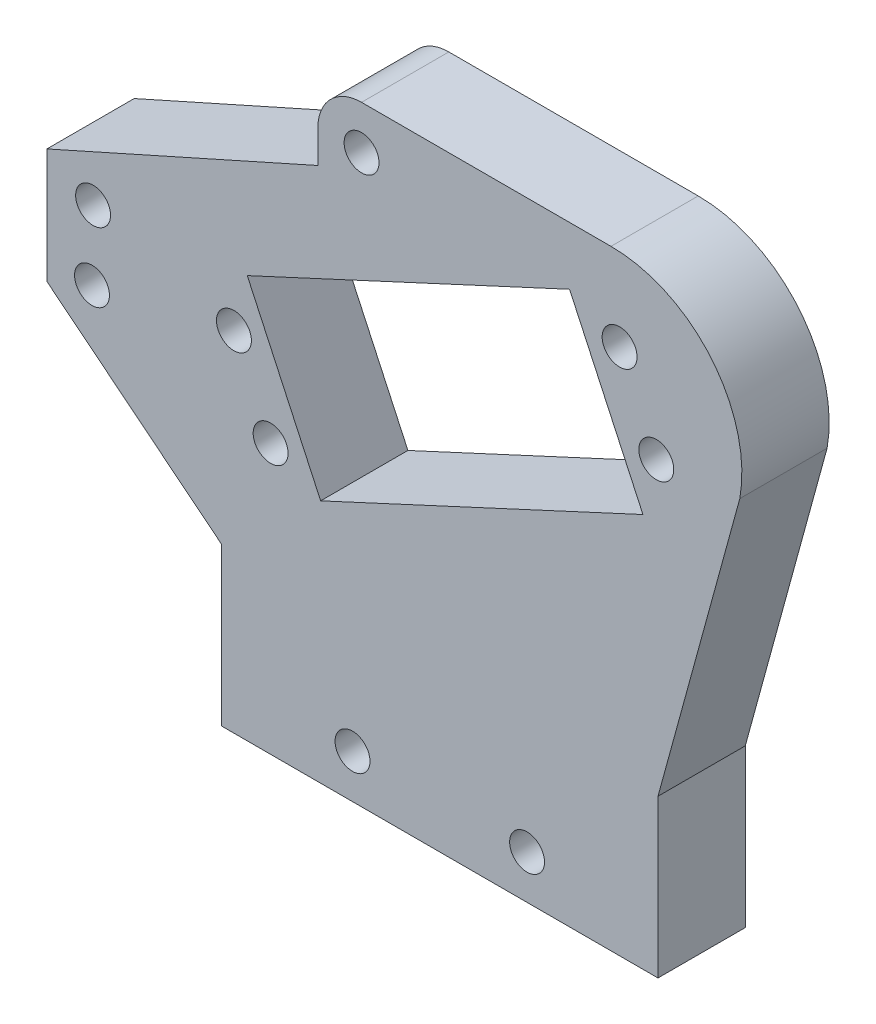
from build123d import *

# Parameters (mm, degrees)
SCHIZZO1_R                   = 2.5
SCHIZZO1_R_2                 = 2
ESTRUSIONE_ESTRUSIONE1_DEPTH = 10
TAGLIO_ESTRUSIONE1_DEPTH     = 76.013178039
SCHIZZO3_R                   = 2
TAGLIO_ESTRUSIONE2_DEPTH     = 76.013178039


with BuildPart() as part:
    # Schizzo1 → Estrusione-Estrusione1 (new body)
    with BuildSketch(Plane.XY):
        with BuildLine():
            Line((15, -50), (-35, -50))
            Line((-35, -50), (-35, -31.964890017))
            Line((-35, -31.964890017), (-55.017968697, -15.891116751))
            Line((-55.017968697, -15.891116751), (-55.017968697, -2.739847716))
            Line((-55.017968697, -2.739847716), (-23.966361252, 11.142047377))
            Line((-23.966361252, 11.142047377), (-23.966361252, 14.909560068))
            ThreePointArc((-23.966361252, 14.909560068), (-22.501895158, 18.445093974), (-18.966361252, 19.909560068))
            Line((-18.966361252, 19.909560068), (9.612052016, 19.909560068))
            ThreePointArc((9.612052016, 19.909560068), (21.117133083, 14.534169651), (24.376307149, 2.260641352))
            Line((24.376307149, 2.260641352), (15, -31.964890017))
            Line((15, -31.964890017), (15, -50))
        make_face()
        Circle(SCHIZZO1_R, mode=Mode.SUBTRACT)
        with Locations((-20, -45)):
            Circle(SCHIZZO1_R_2, mode=Mode.SUBTRACT)
        with Locations((0, -45)):
            Circle(SCHIZZO1_R_2, mode=Mode.SUBTRACT)
        with Locations((-49.725907234, -5.689936133)):
            Circle(SCHIZZO1_R_2, mode=Mode.SUBTRACT)
        with Locations((-49.850768961, -13.68896167)):
            Circle(SCHIZZO1_R_2, mode=Mode.SUBTRACT)
        with Locations((-18.966361252, 14.909560068)):
            Circle(SCHIZZO1_R_2, mode=Mode.SUBTRACT)
    extrude(amount=ESTRUSIONE_ESTRUSIONE1_DEPTH)

    # Schizzo2 → Taglio-Estrusione1 (cut, through all)
    with BuildSketch(Plane.XY.offset(10)):
        with BuildLine():
            Line((-27.856099407, -12.90456221), (-2.268412004, -1.050860115))
            ThreePointArc((-2.268412004, -1.050860115), (-1.050860115, 2.268412004), (2.268412004, 1.050860115))
            Line((2.268412004, 1.050860115), (9.073648015, 4.203440459))
            Line((9.073648015, 4.203440459), (4.870207556, 13.277088475))
            Line((4.870207556, 13.277088475), (-32.059539866, -3.830914194))
            Line((-32.059539866, -3.830914194), (-27.856099407, -12.90456221))
        make_face()
        with BuildLine():
            ThreePointArc((2.5, 0), (0.538038098, -2.441416598), (-2.268412004, -1.050860115))
            Line((-2.268412004, -1.050860115), (-27.856099407, -12.90456221))
            Line((-27.856099407, -12.90456221), (-23.652658948, -21.978210225))
            Line((-23.652658948, -21.978210225), (13.277088475, -4.870207556))
            Line((13.277088475, -4.870207556), (9.073648015, 4.203440459))
            Line((9.073648015, 4.203440459), (2.268412004, 1.050860115))
            ThreePointArc((2.268412004, 1.050860115), (2.441416598, 0.538038098), (2.5, 0))
        make_face()
    extrude(amount=-TAGLIO_ESTRUSIONE1_DEPTH, mode=Mode.SUBTRACT)

    # Schizzo3 → Taglio-Estrusione2 (cut, through all)
    with BuildSketch(Plane.XY.offset(10)):
        with Locations((10.601386992, 10.421640651)):
            Circle(SCHIZZO3_R)
        with Locations((14.804827451, 1.347992635)):
            Circle(SCHIZZO3_R)
        with Locations((-29.383838384, -19.122762401)):
            Circle(SCHIZZO3_R)
        with Locations((-33.587278843, -10.049114386)):
            Circle(SCHIZZO3_R)
    extrude(amount=-TAGLIO_ESTRUSIONE2_DEPTH, mode=Mode.SUBTRACT)


solid = part.part
